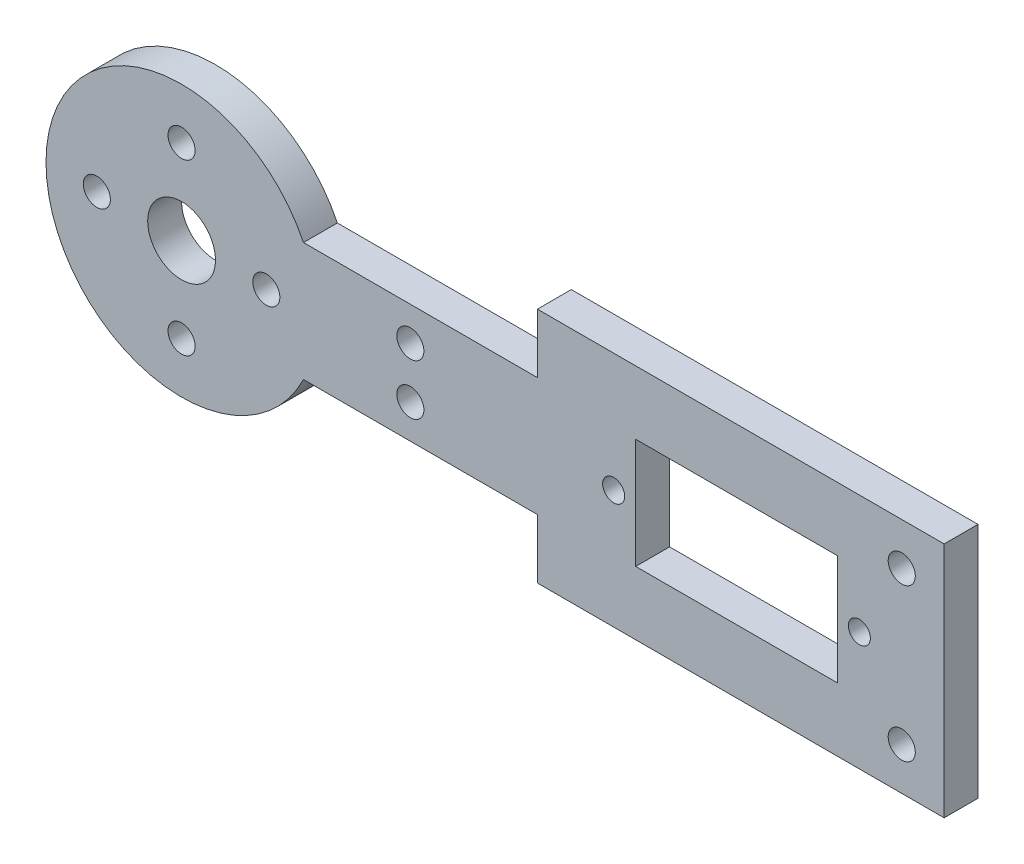
from build123d import *

# Parameters (mm, degrees)
MAIN_WEB_PROFILE_W                     = 60
MAIN_WEB_PROFILE_H                     = 14
MAIN_WEB_DEPTH                         = 4
SHOULDER_HORN_FLANGE_PROFILE_R         = 16
SHOULDER_HORN_FLANGE_DEPTH             = 4
ELBOW_SERVO_MOUNT_PROFILE_W            = 48
ELBOW_SERVO_MOUNT_PROFILE_H            = 28
ELBOW_SERVO_MOUNT_DEPTH                = 4
SG90_BODY_CLEARANCE_START              = -5
SG90_BODY_CLEARANCE_PROFILE_W          = 23.8
SG90_BODY_CLEARANCE_PROFILE_H          = 13
SG90_BODY_CLEARANCE_DEPTH              = 97.49863387
ELBOW_TAB_FASTENERS_START              = -50
ELBOW_TAB_FASTENERS_PROFILE_R          = 1.3
ELBOW_TAB_FASTENERS_DEPTH              = 142.49863387
SHOULDER_CENTER_SCREW_ACCESS_START     = -50
SHOULDER_CENTER_SCREW_ACCESS_PROFILE_R = 4
SHOULDER_CENTER_SCREW_ACCESS_DEPTH     = 142.49863387
SHOULDER_HORN_BOLT_PATTERN_START       = -50
SHOULDER_HORN_BOLT_PATTERN_PROFILE_R   = 1.6
SHOULDER_HORN_BOLT_PATTERN_DEPTH       = 142.49863387
CABLE_TIE_HOLES_START                  = -50
CABLE_TIE_HOLES_PROFILE_R              = 1.6
CABLE_TIE_HOLES_DEPTH                  = 142.49863387
PASSIVE_CHEEK_STANDOFFS_START          = -50
PASSIVE_CHEEK_STANDOFFS_PROFILE_R      = 1.6
PASSIVE_CHEEK_STANDOFFS_DEPTH          = 142.49863387


with BuildPart() as part:
    # Main_web_profile → Main_web (new body)
    with BuildSketch(Plane.XY):
        with Locations((30, 0)):
            Rectangle(MAIN_WEB_PROFILE_W, MAIN_WEB_PROFILE_H)
    extrude(amount=MAIN_WEB_DEPTH)

    # Shoulder_horn_flange_profile → Shoulder_horn_flange (add)
    with BuildSketch(Plane.XY):
        Circle(SHOULDER_HORN_FLANGE_PROFILE_R)
    extrude(amount=SHOULDER_HORN_FLANGE_DEPTH)

    # Elbow_servo_mount_profile → Elbow_servo_mount (add)
    with BuildSketch(Plane.XY):
        with Locations((66, 0)):
            Rectangle(ELBOW_SERVO_MOUNT_PROFILE_W, ELBOW_SERVO_MOUNT_PROFILE_H)
    extrude(amount=ELBOW_SERVO_MOUNT_DEPTH)

    # SG90_body_clearance_profile → SG90_body_clearance (cut, through all)
    with BuildSketch(Plane.XY.offset(SG90_BODY_CLEARANCE_START)):
        with Locations((65.5, 0)):
            Rectangle(SG90_BODY_CLEARANCE_PROFILE_W, SG90_BODY_CLEARANCE_PROFILE_H)
    extrude(amount=SG90_BODY_CLEARANCE_DEPTH, mode=Mode.SUBTRACT)

    # Elbow_tab_fasteners_profile → Elbow_tab_fasteners (cut, through all)
    with BuildSketch(Plane.XY.offset(ELBOW_TAB_FASTENERS_START)):
        with Locations(Location((51, 0, 0), (0, 0, 180))):
            Circle(ELBOW_TAB_FASTENERS_PROFILE_R)
        with Locations(Location((80, 0, 0), (0, 0, 180))):
            Circle(ELBOW_TAB_FASTENERS_PROFILE_R)
    extrude(amount=ELBOW_TAB_FASTENERS_DEPTH, mode=Mode.SUBTRACT)

    # Shoulder_center_screw_access_profile → Shoulder_center_screw_access (cut, through all)
    with BuildSketch(Plane.XY.offset(SHOULDER_CENTER_SCREW_ACCESS_START)):
        with Locations(Location((0, 0, 0), (0, 0, 180))):
            Circle(SHOULDER_CENTER_SCREW_ACCESS_PROFILE_R)
    extrude(amount=SHOULDER_CENTER_SCREW_ACCESS_DEPTH, mode=Mode.SUBTRACT)

    # Shoulder_horn_bolt_pattern_profile → Shoulder_horn_bolt_pattern (cut, through all)
    with BuildSketch(Plane.XY.offset(SHOULDER_HORN_BOLT_PATTERN_START)):
        with Locations(Location((0, 10, 0), (0, 0, 180))):
            Circle(SHOULDER_HORN_BOLT_PATTERN_PROFILE_R)
        with Locations(Location((0, -10, 0), (0, 0, 180))):
            Circle(SHOULDER_HORN_BOLT_PATTERN_PROFILE_R)
        with Locations(Location((10, 0, 0), (0, 0, 180))):
            Circle(SHOULDER_HORN_BOLT_PATTERN_PROFILE_R)
        with Locations(Location((-10, 0, 0), (0, 0, 180))):
            Circle(SHOULDER_HORN_BOLT_PATTERN_PROFILE_R)
    extrude(amount=SHOULDER_HORN_BOLT_PATTERN_DEPTH, mode=Mode.SUBTRACT)

    # Cable_tie_holes_profile → Cable_tie_holes (cut, through all)
    with BuildSketch(Plane.XY.offset(CABLE_TIE_HOLES_START)):
        with Locations(Location((27, -3, 0), (0, 0, 180))):
            Circle(CABLE_TIE_HOLES_PROFILE_R)
        with Locations(Location((27, 3, 0), (0, 0, 180))):
            Circle(CABLE_TIE_HOLES_PROFILE_R)
    extrude(amount=CABLE_TIE_HOLES_DEPTH, mode=Mode.SUBTRACT)

    # Passive_cheek_standoffs_profile → Passive_cheek_standoffs (cut, through all)
    with BuildSketch(Plane.XY.offset(PASSIVE_CHEEK_STANDOFFS_START)):
        with Locations(Location((85, -9, 0), (0, 0, 180))):
            Circle(PASSIVE_CHEEK_STANDOFFS_PROFILE_R)
        with Locations(Location((85, 9, 0), (0, 0, 180))):
            Circle(PASSIVE_CHEEK_STANDOFFS_PROFILE_R)
    extrude(amount=PASSIVE_CHEEK_STANDOFFS_DEPTH, mode=Mode.SUBTRACT)


solid = part.part
